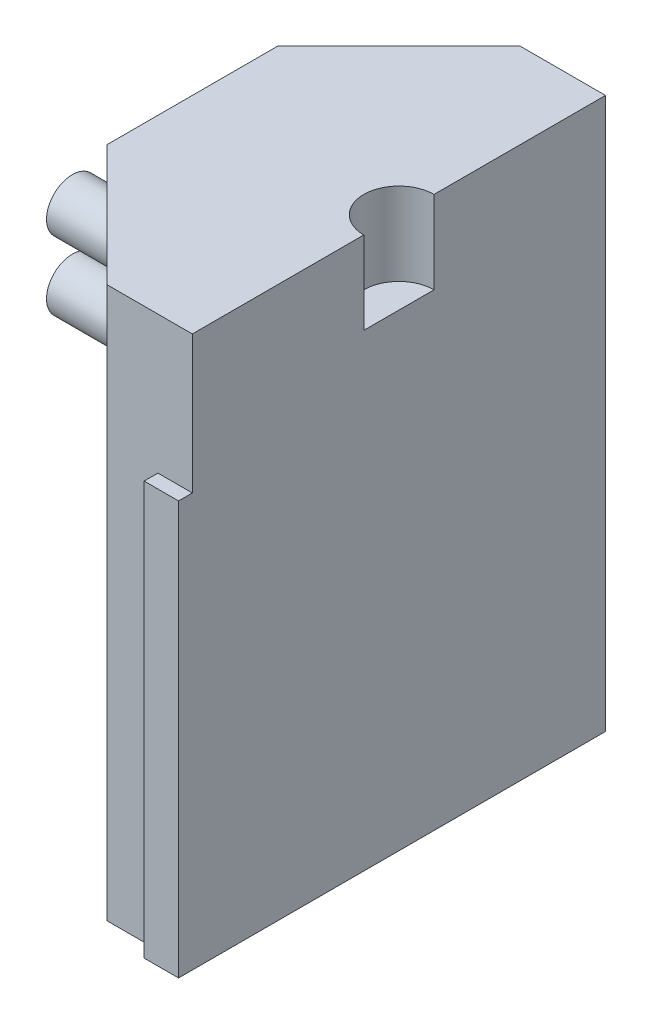
from build123d import *

# Parameters (mm, degrees)
BOSS_EXTRUDE1_DEPTH      = 80
CUT_EXTRUDE1_DEPTH       = 1.1
SKETCH4_W                = 30
SKETCH4_H                = 60
CUT_EXTRUDE2_DEPTH       = 91.553851381
SKETCH5_R                = 5.1
CUT_EXTRUDE3_DEPTH       = 12
BOSS_EXTRUDE2_DEPTH      = 5
BOSS_EXTRUDE2_DEPTH_BACK = 12
SKETCH6_R                = 3.75
SKETCH6_W                = 10
SKETCH6_H                = 10
SKETCH7_W                = 5
SKETCH7_H                = 60
BOSS_EXTRUDE3_DEPTH      = 2
SKETCH8_W                = 5.1
SKETCH8_H                = 5.1
CUT_EXTRUDE4_DEPTH       = 106.948100502


with BuildPart() as part:
    # Sketch1 → Boss-Extrude1 (new body)
    with BuildSketch(Plane(origin=(0, 0, 0), x_dir=(1, 0, 0), z_dir=(0, 1, 0))):
        Polygon((12.426406871, -30), (30, -12.426406871), (30, 12.426406871), (12.426406871, 30), (-12.426406871, 30), (-30, 12.426406871), (-30, -12.426406871), (-12.426406871, -30), align=None)
    extrude(amount=BOSS_EXTRUDE1_DEPTH)

    # Sketch3 → Cut-Extrude1 (cut, symmetric)
    with BuildSketch(Plane(origin=(0, 40, 0), x_dir=(1, 0, 0), z_dir=(0, 1, 0))):
        Polygon((40, 25), (10, 5.1), (10, -5.1), (40, -25), align=None)
    cut_extrude1 = extrude(amount=CUT_EXTRUDE1_DEPTH, both=True, mode=Mode.SUBTRACT)

    # Mirror1: Cut-Extrude1 across plane
    add(cut_extrude1.mirror(Plane(origin=(0, 0, 0), x_dir=(0, 0, 1), z_dir=(1, 0, 0))), mode=Mode.SUBTRACT)

    # Sketch4 → Cut-Extrude2 (cut, through all)
    with BuildSketch(Plane(origin=(0, 80, 0), x_dir=(1, 0, 0), z_dir=(0, 1, 0))):
        with Locations((15, 0)):
            Rectangle(SKETCH4_W, SKETCH4_H)
    extrude(amount=-CUT_EXTRUDE2_DEPTH, mode=Mode.SUBTRACT)

    # Sketch5 → Cut-Extrude3 (cut)
    with BuildSketch(Plane(origin=(0, 80, 0), x_dir=(1, 0, 0), z_dir=(0, 1, 0))):
        Circle(SKETCH5_R)
    extrude(amount=-CUT_EXTRUDE3_DEPTH, mode=Mode.SUBTRACT)

    # Sketch6 → Boss-Extrude2 (add, two sides: drawn at the far end of the back side and taken through both)
    with BuildSketch(Plane.ZY.offset(30).offset(-BOSS_EXTRUDE2_DEPTH_BACK)):
        with Locations((12.426406871, 70)):
            Circle(SKETCH6_R)
        with Locations((12.426406871, 60)):
            Circle(SKETCH6_R)
        with Locations((0, 15)):
            Rectangle(SKETCH6_W, SKETCH6_H)
    extrude(amount=BOSS_EXTRUDE2_DEPTH + BOSS_EXTRUDE2_DEPTH_BACK)

    # Sketch7 → Boss-Extrude3 (add)
    with BuildSketch(Plane.XY.offset(30)):
        with Locations((-2.5, 30)):
            Rectangle(SKETCH7_W, SKETCH7_H)
    extrude(amount=BOSS_EXTRUDE3_DEPTH)

    # Sketch8 → Cut-Extrude4 (cut, through all)
    with BuildSketch(Plane.XY.offset(30)):
        with Locations((-27.45, 2.55)):
            Rectangle(SKETCH8_W, SKETCH8_H)
    extrude(amount=-CUT_EXTRUDE4_DEPTH, mode=Mode.SUBTRACT)


solid = part.part
